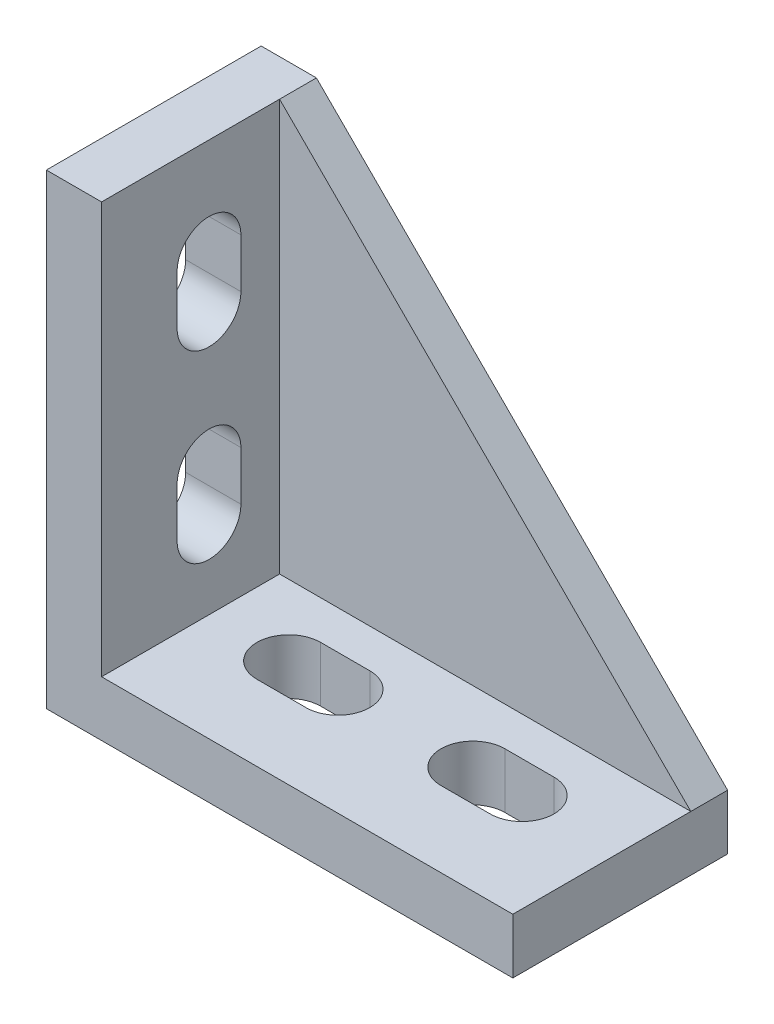
from build123d import *

# Parameters (mm, degrees)
BOSS_EXTRUDE1_DEPTH = 8.75
BOSS_EXTRUDE2_DEPTH = 3
CUT_EXTRUDE1_DEPTH  = 4.5
CUT_EXTRUDE2_DEPTH  = 4.5


with BuildPart() as part:
    # Sketch1 → Boss-Extrude1 (new, symmetric)
    with BuildSketch(Plane.XY):
        Polygon((0, 0), (0, 38), (4.5, 38), (4.5, 4.5), (38, 4.5), (38, 0), align=None)
    extrude(amount=BOSS_EXTRUDE1_DEPTH, both=True)

    # Sketch2 → Boss-Extrude2 (add)
    with BuildSketch(Plane(origin=(0, 0, -8.75), x_dir=(-1, 0, 0), z_dir=(0, 0, -1))):
        Polygon((-4.5, 38), (-38, 4.5), (-38, 0), (0, 0), (0, 38), align=None)
    extrude(amount=-BOSS_EXTRUDE2_DEPTH)

    # Sketch3 → Cut-Extrude1 (cut)
    with BuildSketch(Plane(origin=(0, 4.5, 0), x_dir=(1, 0, 0), z_dir=(0, 1, 0))):
        with BuildLine():
            Line((30, -2.6), (26, -2.6))
            ThreePointArc((26, -2.6), (23.4, 0), (26, 2.6))
            Line((26, 2.6), (30, 2.6))
            ThreePointArc((30, 2.6), (32.6, 0), (30, -2.6))
        make_face()
        with BuildLine():
            Line((11, 2.6), (15, 2.6))
            ThreePointArc((15, 2.6), (17.6, 0), (15, -2.6))
            Line((15, -2.6), (11, -2.6))
            ThreePointArc((11, -2.6), (8.4, 0), (11, 2.6))
        make_face()
    extrude(amount=-CUT_EXTRUDE1_DEPTH, mode=Mode.SUBTRACT)

    # Sketch4 → Cut-Extrude2 (cut)
    with BuildSketch(Plane(origin=(4.5, 0, 0), x_dir=(0, 0, -1), z_dir=(1, 0, 0))):
        with BuildLine():
            Line((2.6, 30), (2.6, 26))
            ThreePointArc((2.6, 26), (0, 23.4), (-2.6, 26))
            Line((-2.6, 26), (-2.6, 30))
            ThreePointArc((-2.6, 30), (0, 32.6), (2.6, 30))
        make_face()
        with BuildLine():
            Line((2.6, 15), (2.6, 11))
            ThreePointArc((2.6, 11), (0, 8.4), (-2.6, 11))
            Line((-2.6, 11), (-2.6, 15))
            ThreePointArc((-2.6, 15), (0, 17.6), (2.6, 15))
        make_face()
    extrude(amount=-CUT_EXTRUDE2_DEPTH, mode=Mode.SUBTRACT)


solid = part.part
